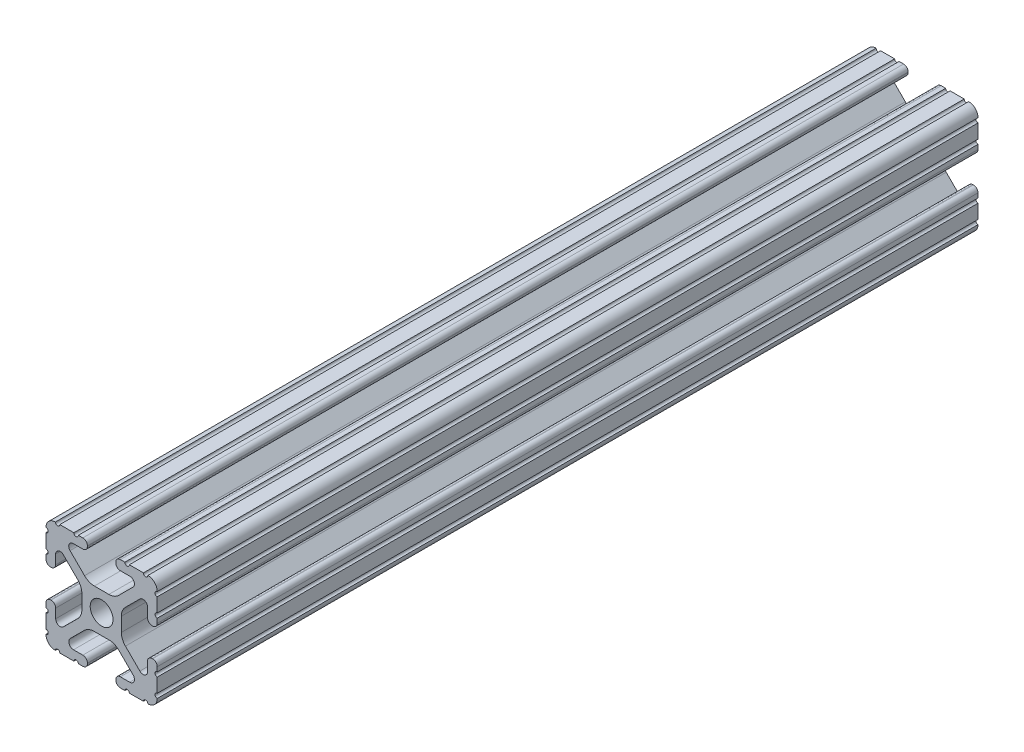
from build123d import *

# Parameters (mm, degrees)
SKETCH1_R           = 2.6035
BOSS_EXTRUDE1_DEPTH = 93.726


with BuildPart() as part:
    # Sketch1 → Boss-Extrude1 (new, symmetric)
    with BuildSketch(Plane.XY):
        with BuildLine():
            Line((-7.179650497, -8.645192506), (-3.952270251, -5.423690499))
            ThreePointArc((-3.952270251, -5.423690499), (-2.922936451, -4.736929036), (-1.709253557, -4.4958))
            Line((-1.709253557, -4.4958), (1.709253557, -4.4958))
            ThreePointArc((1.709253557, -4.4958), (2.922936451, -4.736929036), (3.952270251, -5.423690499))
            Line((3.952270251, -5.423690499), (7.179650497, -8.645192506))
            ThreePointArc((7.179650497, -8.645192506), (7.41473083, -9.822813117), (6.416408329, -10.4902))
            Line((6.416408329, -10.4902), (4.287512407, -10.4902))
            ThreePointArc((4.287512407, -10.4902), (3.54574862, -10.79744862), (3.2385, -11.539212407))
            Line((3.2385, -11.539212407), (3.2385, -11.650987593))
            ThreePointArc((3.2385, -11.650987593), (3.54574862, -12.39275138), (4.287512407, -12.7))
            Line((4.287512407, -12.7), (5.317126718, -12.7))
            ThreePointArc((5.317126718, -12.7), (5.825126718, -12.192), (6.333126718, -12.7))
            Line((6.333126718, -12.7), (9.550443118, -12.7))
            ThreePointArc((9.550443118, -12.7), (10.058366869, -12.192000006), (10.566443095, -12.699847501))
            ThreePointArc((10.566443095, -12.699847501), (12.082537762, -12.08250727), (12.699846982, -10.566399977))
            ThreePointArc((12.699846982, -10.566399977), (12.192000006, -10.058323491), (12.7, -9.5504))
            Line((12.7, -9.5504), (12.7, -6.3330836))
            ThreePointArc((12.7, -6.3330836), (12.192, -5.8250836), (12.7, -5.3170836))
            Line((12.7, -5.3170836), (12.7, -4.287469289))
            ThreePointArc((12.7, -4.287469289), (12.39275138, -3.545705502), (11.650987593, -3.238456882))
            Line((11.650987593, -3.238456882), (11.539212407, -3.238456882))
            ThreePointArc((11.539212407, -3.238456882), (10.79744862, -3.545705502), (10.4902, -4.287469289))
            Line((10.4902, -4.287469289), (10.4902, -6.402089023))
            ThreePointArc((10.4902, -6.402089023), (9.856505071, -7.351067942), (8.737131347, -7.129408934))
            Line((8.737131347, -7.129408934), (5.441005833, -3.840816462))
            ThreePointArc((5.441005833, -3.840816462), (4.750877967, -2.809883091), (4.5085, -1.593185507))
            Line((4.5085, -1.593185507), (4.5085, 1.593185507))
            ThreePointArc((4.5085, 1.593185507), (4.750877967, 2.809883091), (5.441005833, 3.840816462))
            Line((5.441005833, 3.840816462), (8.737131347, 7.129408934))
            ThreePointArc((8.737131347, 7.129408934), (9.856505071, 7.351067942), (10.4902, 6.402089023))
            Line((10.4902, 6.402089023), (10.4902, 4.287469289))
            ThreePointArc((10.4902, 4.287469289), (10.79744862, 3.545705502), (11.539212407, 3.238456882))
            Line((11.539212407, 3.238456882), (11.650987593, 3.238456882))
            ThreePointArc((11.650987593, 3.238456882), (12.39275138, 3.545705502), (12.7, 4.287469289))
            Line((12.7, 4.287469289), (12.7, 5.3170836))
            ThreePointArc((12.7, 5.3170836), (12.192, 5.8250836), (12.7, 6.3330836))
            Line((12.7, 6.3330836), (12.7, 9.5504))
            ThreePointArc((12.7, 9.5504), (12.192000006, 10.058323491), (12.699846982, 10.566399977))
            ThreePointArc((12.699846982, 10.566399977), (12.082537762, 12.08250727), (10.566443095, 12.699847501))
            ThreePointArc((10.566443095, 12.699847501), (10.058366869, 12.192000006), (9.550443118, 12.7))
            Line((9.550443118, 12.7), (6.333126718, 12.7))
            ThreePointArc((6.333126718, 12.7), (5.825126718, 12.192), (5.317126718, 12.7))
            Line((5.317126718, 12.7), (4.287512407, 12.7))
            ThreePointArc((4.287512407, 12.7), (3.54574862, 12.39275138), (3.2385, 11.650987593))
            Line((3.2385, 11.650987593), (3.2385, 11.539212407))
            ThreePointArc((3.2385, 11.539212407), (3.54574862, 10.79744862), (4.287512407, 10.4902))
            Line((4.287512407, 10.4902), (6.476788598, 10.4902))
            ThreePointArc((6.476788598, 10.4902), (7.432222385, 9.85140422), (7.207036008, 8.724370562))
            Line((7.207036008, 8.724370562), (3.898272566, 5.423169045))
            ThreePointArc((3.898272566, 5.423169045), (2.869120213, 4.736787962), (1.655778399, 4.4958))
            Line((1.655778399, 4.4958), (-1.655778399, 4.4958))
            ThreePointArc((-1.655778399, 4.4958), (-2.869120213, 4.736787962), (-3.898272566, 5.423169045))
            Line((-3.898272566, 5.423169045), (-7.207036008, 8.724370562))
            ThreePointArc((-7.207036008, 8.724370562), (-7.432222385, 9.85140422), (-6.476788598, 10.4902))
            Line((-6.476788598, 10.4902), (-4.287512407, 10.4902))
            ThreePointArc((-4.287512407, 10.4902), (-3.54574862, 10.79744862), (-3.2385, 11.539212407))
            Line((-3.2385, 11.539212407), (-3.2385, 11.650987593))
            ThreePointArc((-3.2385, 11.650987593), (-3.54574862, 12.39275138), (-4.287512407, 12.7))
            Line((-4.287512407, 12.7), (-5.317126718, 12.7))
            ThreePointArc((-5.317126718, 12.7), (-5.825126718, 12.192), (-6.333126718, 12.7))
            Line((-6.333126718, 12.7), (-9.550443118, 12.7))
            ThreePointArc((-9.550443118, 12.7), (-10.058366869, 12.192000006), (-10.566443095, 12.699847501))
            ThreePointArc((-10.566443095, 12.699847501), (-12.082537762, 12.08250727), (-12.699846982, 10.566399977))
            ThreePointArc((-12.699846982, 10.566399977), (-12.192000006, 10.058323491), (-12.7, 9.5504))
            Line((-12.7, 9.5504), (-12.7, 6.3330836))
            ThreePointArc((-12.7, 6.3330836), (-12.192, 5.8250836), (-12.7, 5.3170836))
            Line((-12.7, 5.3170836), (-12.7, 4.287469289))
            ThreePointArc((-12.7, 4.287469289), (-12.39275138, 3.545705502), (-11.650987593, 3.238456882))
            Line((-11.650987593, 3.238456882), (-11.539212407, 3.238456882))
            ThreePointArc((-11.539212407, 3.238456882), (-10.79744862, 3.545705502), (-10.4902, 4.287469289))
            Line((-10.4902, 4.287469289), (-10.4902, 6.402089023))
            ThreePointArc((-10.4902, 6.402089023), (-9.856505071, 7.351067942), (-8.737131347, 7.129408934))
            Line((-8.737131347, 7.129408934), (-5.441005833, 3.840816462))
            ThreePointArc((-5.441005833, 3.840816462), (-4.750877967, 2.809883091), (-4.5085, 1.593185507))
            Line((-4.5085, 1.593185507), (-4.5085, -1.593185507))
            ThreePointArc((-4.5085, -1.593185507), (-4.750877967, -2.809883091), (-5.441005833, -3.840816462))
            Line((-5.441005833, -3.840816462), (-8.737131347, -7.129408934))
            ThreePointArc((-8.737131347, -7.129408934), (-9.856505071, -7.351067942), (-10.4902, -6.402089023))
            Line((-10.4902, -6.402089023), (-10.4902, -4.287469289))
            ThreePointArc((-10.4902, -4.287469289), (-10.79744862, -3.545705502), (-11.539212407, -3.238456882))
            Line((-11.539212407, -3.238456882), (-11.650987593, -3.238456882))
            ThreePointArc((-11.650987593, -3.238456882), (-12.39275138, -3.545705502), (-12.7, -4.287469289))
            Line((-12.7, -4.287469289), (-12.7, -5.3170836))
            ThreePointArc((-12.7, -5.3170836), (-12.192, -5.8250836), (-12.7, -6.3330836))
            Line((-12.7, -6.3330836), (-12.7, -9.5504))
            ThreePointArc((-12.7, -9.5504), (-12.192000006, -10.058323491), (-12.699846982, -10.566399977))
            ThreePointArc((-12.699846982, -10.566399977), (-12.082537762, -12.08250727), (-10.566443095, -12.699847501))
            ThreePointArc((-10.566443095, -12.699847501), (-10.058366869, -12.192000006), (-9.550443118, -12.7))
            Line((-9.550443118, -12.7), (-6.333126718, -12.7))
            ThreePointArc((-6.333126718, -12.7), (-5.825126718, -12.192), (-5.317126718, -12.7))
            Line((-5.317126718, -12.7), (-4.287512407, -12.7))
            ThreePointArc((-4.287512407, -12.7), (-3.54574862, -12.39275138), (-3.2385, -11.650987593))
            Line((-3.2385, -11.650987593), (-3.2385, -11.539212407))
            ThreePointArc((-3.2385, -11.539212407), (-3.54574862, -10.79744862), (-4.287512407, -10.4902))
            Line((-4.287512407, -10.4902), (-6.416408329, -10.4902))
            ThreePointArc((-6.416408329, -10.4902), (-7.41473083, -9.822813117), (-7.179650497, -8.645192506))
        make_face()
        Circle(SKETCH1_R, mode=Mode.SUBTRACT)
    extrude(amount=BOSS_EXTRUDE1_DEPTH, both=True)


solid = part.part
